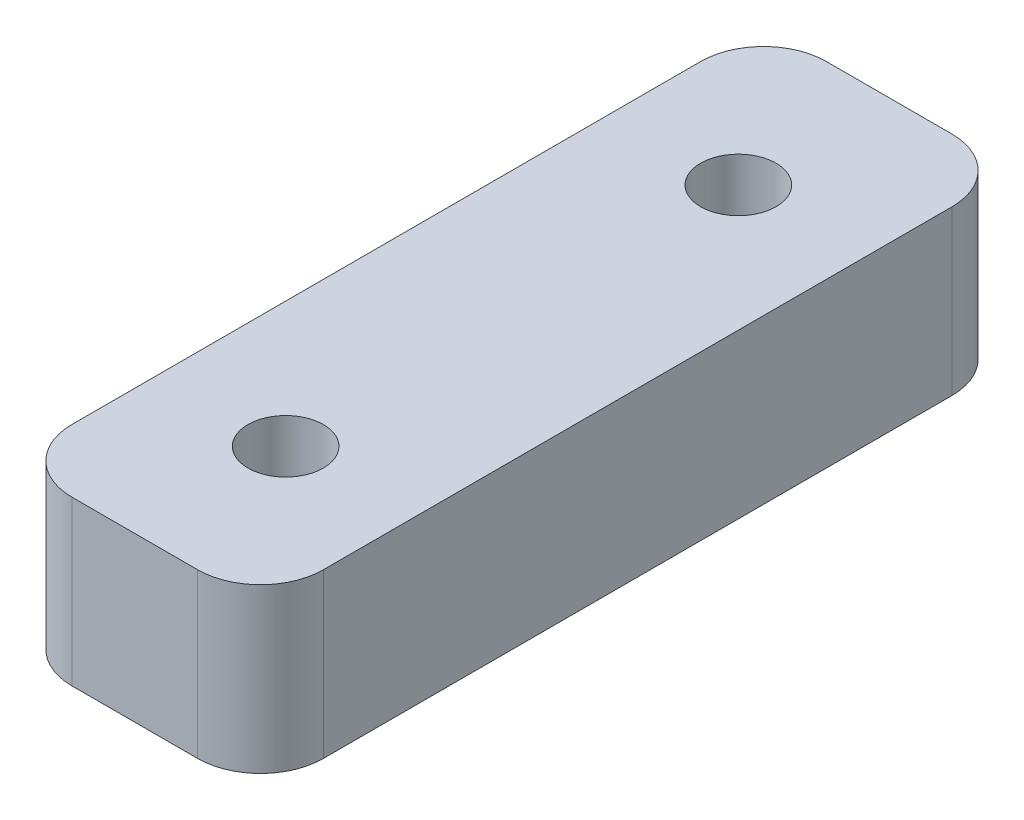
from build123d import *

# Parameters (mm, degrees)
BOSS_EXTRUDE1_DEPTH   = 13
F_6_0MM_DOWEL_HOLE1_D = 6


with BuildPart() as part:
    # Sketch1 → Boss-Extrude1 (new body)
    with BuildSketch(Plane(origin=(0, 0, 0), x_dir=(1, 0, 0), z_dir=(0, 1, 0))):
        with BuildLine():
            Line((5, 0), (15, 0))
            ThreePointArc((15, 0), (18.535533906, 1.464466094), (20, 5))
            Line((20, 5), (20, 55))
            ThreePointArc((20, 55), (18.535533906, 58.535533906), (15, 60))
            Line((15, 60), (5, 60))
            ThreePointArc((5, 60), (1.464466094, 58.535533906), (0, 55))
            Line((0, 55), (0, 5))
            ThreePointArc((0, 5), (1.464466094, 1.464466094), (5, 0))
        make_face()
    extrude(amount=BOSS_EXTRUDE1_DEPTH)

    # Ø6.0mm Dowel Hole1 (through all)
    with Locations(Plane(origin=(0, 13, 0), x_dir=(1, 0, 0), z_dir=(0, 1, 0))):
        with Locations((10, 12), (10, 48)):
            Hole(F_6_0MM_DOWEL_HOLE1_D / 2)


solid = part.part
